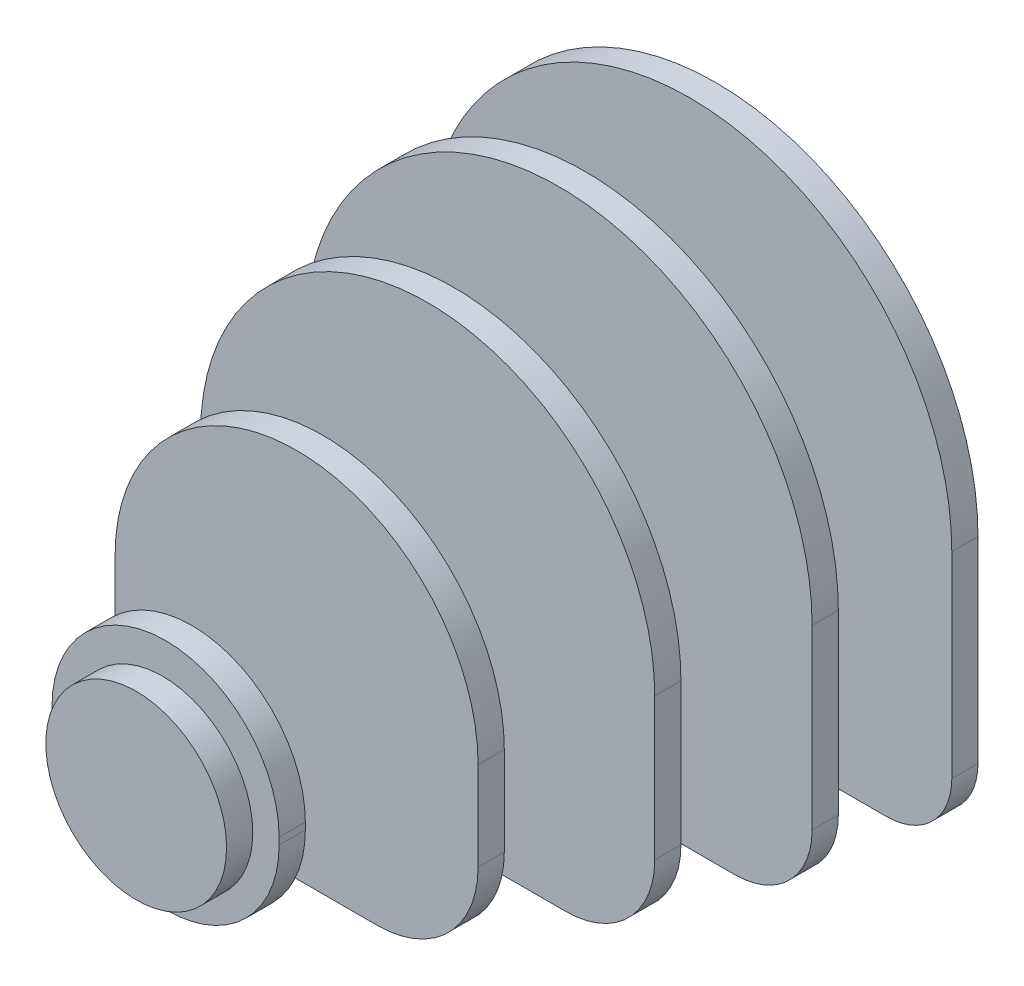
from build123d import *

# Parameters (mm, degrees)
BOSS_EXTRUDE1_DEPTH = 10
BOSS_EXTRUDE2_DEPTH = 10
BOSS_EXTRUDE3_DEPTH = 10
BOSS_EXTRUDE4_DEPTH = 10
BOSS_EXTRUDE5_DEPTH = 10
SKETCH8_R           = 34.482758621
BOSS_EXTRUDE6_DEPTH = 10


with BuildPart() as part:
    # Sketch1 → Boss-Extrude1 (new body)
    with BuildSketch(Plane.XY):
        with BuildLine():
            Line((100, 0), (100, -75))
            ThreePointArc((100, -75), (92.67766953, -92.67766953), (75, -100))
            Line((75, -100), (-75, -100))
            ThreePointArc((-75, -100), (-92.67766953, -92.67766953), (-100, -75))
            Line((-100, -75), (-100, 0))
            ThreePointArc((-100, 0), (0, 100), (100, 0))
        make_face()
    extrude(amount=BOSS_EXTRUDE1_DEPTH)


with BuildPart() as body_2:
    # Sketch4 → Boss-Extrude2 (new body)
    with BuildSketch(Plane.XY.offset(50)):
        with BuildLine():
            Line((96.707090819, -1.024763326), (96.707090819, -68.645600892))
            ThreePointArc((96.707090819, -68.645600892), (88.066740864, -89.505250937), (67.207090819, -98.145600892))
            Line((67.207090819, -98.145600892), (-67.207090819, -98.145600892))
            ThreePointArc((-67.207090819, -98.145600892), (-88.066740864, -89.505250937), (-96.707090819, -68.645600892))
            Line((-96.707090819, -68.645600892), (-96.707090819, -1.024763326))
            ThreePointArc((-96.707090819, -1.024763326), (0, 95.682327493), (96.707090819, -1.024763326))
        make_face()
    extrude(amount=BOSS_EXTRUDE2_DEPTH)


with BuildPart() as body_3:
    # Sketch5 → Boss-Extrude3 (new body)
    with BuildSketch(Plane.XY.offset(100)):
        with BuildLine():
            Line((86.651566319, -4.330195939), (86.651566319, -58.551496141))
            ThreePointArc((86.651566319, -58.551496141), (76.693196879, -82.593126701), (52.651566319, -92.551496141))
            Line((52.651566319, -92.551496141), (-52.651566319, -92.551496141))
            ThreePointArc((-52.651566319, -92.551496141), (-76.693196879, -82.593126701), (-86.651566319, -58.551496141))
            Line((-86.651566319, -58.551496141), (-86.651566319, -4.330195939))
            ThreePointArc((-86.651566319, -4.330195939), (0, 82.32137038), (86.651566319, -4.330195939))
        make_face()
    extrude(amount=BOSS_EXTRUDE3_DEPTH)


with BuildPart() as body_4:
    # Sketch6 → Boss-Extrude4 (new body)
    with BuildSketch(Plane.XY.offset(150)):
        with BuildLine():
            Line((-30.75187232, -83.122329054), (30.75187232, -83.122329054))
            ThreePointArc((30.75187232, -83.122329054), (57.975483396, -71.84594013), (69.25187232, -44.622329054))
            Line((69.25187232, -44.622329054), (69.25187232, -10.779688657))
            ThreePointArc((69.25187232, -10.779688657), (0, 58.472183663), (-69.25187232, -10.779688657))
            Line((-69.25187232, -10.779688657), (-69.25187232, -44.622329054))
            ThreePointArc((-69.25187232, -44.622329054), (-57.975483396, -71.84594013), (-30.75187232, -83.122329054))
        make_face()
    extrude(amount=BOSS_EXTRUDE4_DEPTH)


with BuildPart() as body_5:
    # Sketch7 → Boss-Extrude5 (new body)
    with BuildSketch(Plane.XY.offset(200)):
        with BuildLine():
            Line((-0.329054315, -68.301270189), (0.329054315, -68.301270189))
            ThreePointArc((0.329054315, -68.301270189), (30.734645906, -55.70686178), (43.329054315, -25.301270189))
            Line((43.329054315, -25.301270189), (43.329054315, -22.700067601))
            ThreePointArc((43.329054315, -22.700067601), (0, 20.628986714), (-43.329054315, -22.700067601))
            Line((-43.329054315, -22.700067601), (-43.329054315, -25.301270189))
            ThreePointArc((-43.329054315, -25.301270189), (-30.734645906, -55.70686178), (-0.329054315, -68.301270189))
        make_face()
    extrude(amount=BOSS_EXTRUDE5_DEPTH)


with BuildPart() as body_6:
    # Sketch8 → Boss-Extrude6 (new body)
    with BuildSketch(Plane.XY.offset(211.206896552)):
        with Locations((0, -25)):
            Circle(SKETCH8_R)
    extrude(amount=BOSS_EXTRUDE6_DEPTH)


solid = Compound([part.part, body_2.part, body_3.part, body_4.part, body_5.part, body_6.part])
